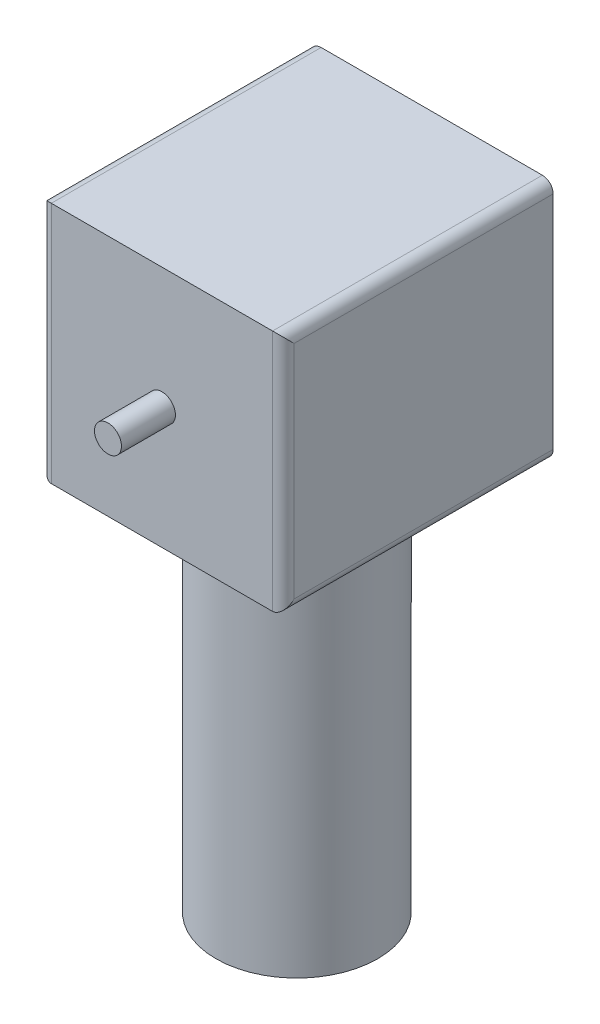
from build123d import *

# Parameters (mm, degrees)
SKETCH1_W           = 45
SKETCH1_H           = 45
BOSS_EXTRUDE1_DEPTH = 50
SKETCH4_R           = 15
BOSS_EXTRUDE2_DEPTH = 71
FILLET1_R           = 2
FILLET2_R           = 5
SKETCH5_R           = 2.5
BOSS_EXTRUDE3_DEPTH = 10
BOSS_EXTRUDE4_START = 10
SKETCH6_R           = 2.5
BOSS_EXTRUDE4_DEPTH = 10


with BuildPart() as part:
    # Sketch1 → Boss-Extrude1 (new body)
    with BuildSketch(Plane.XY):
        Rectangle(SKETCH1_W, SKETCH1_H)
    extrude(amount=BOSS_EXTRUDE1_DEPTH)

    # Sketch4 → Boss-Extrude2 (add)
    with BuildSketch(Plane.XZ.offset(22.5)):
        with Locations(Location((0, 25, 0), (0, 0, 270))):
            Circle(SKETCH4_R)
    extrude(amount=BOSS_EXTRUDE2_DEPTH)

    # Fillet1
    fillet1_edges = [part.edges().sort_by_distance(p)[0] for p in [
        (-22.5, 0, 50),
        (22.5, 0, 50),
        (22.5, -22.5, 25),
        (-22.5, -22.5, 25),
        (-22.5, 22.5, 25),
        (22.5, 22.5, 25),
    ]]
    fillet(fillet1_edges, radius=FILLET1_R)

    # Fillet2
    fillet2_edges = [part.edges().sort_by_distance(p)[0] for p in [
        (0, -22.5, 40),
    ]]
    fillet(fillet2_edges, radius=FILLET2_R)

    # Sketch5 → Boss-Extrude3 (add)
    with BuildSketch(Plane.XY.offset(50)):
        Circle(SKETCH5_R)
    extrude(amount=BOSS_EXTRUDE3_DEPTH)

    # Sketch6 → Boss-Extrude4 (add)
    with BuildSketch(Plane(origin=(0, 0, 0), x_dir=(-1, 0, 0), z_dir=(0, 0, -1)).offset(BOSS_EXTRUDE4_START)):
        with Locations(Location((0, 0, 0), (0, 0, 180))):
            Circle(SKETCH6_R)
    extrude(amount=-BOSS_EXTRUDE4_DEPTH)


solid = part.part
